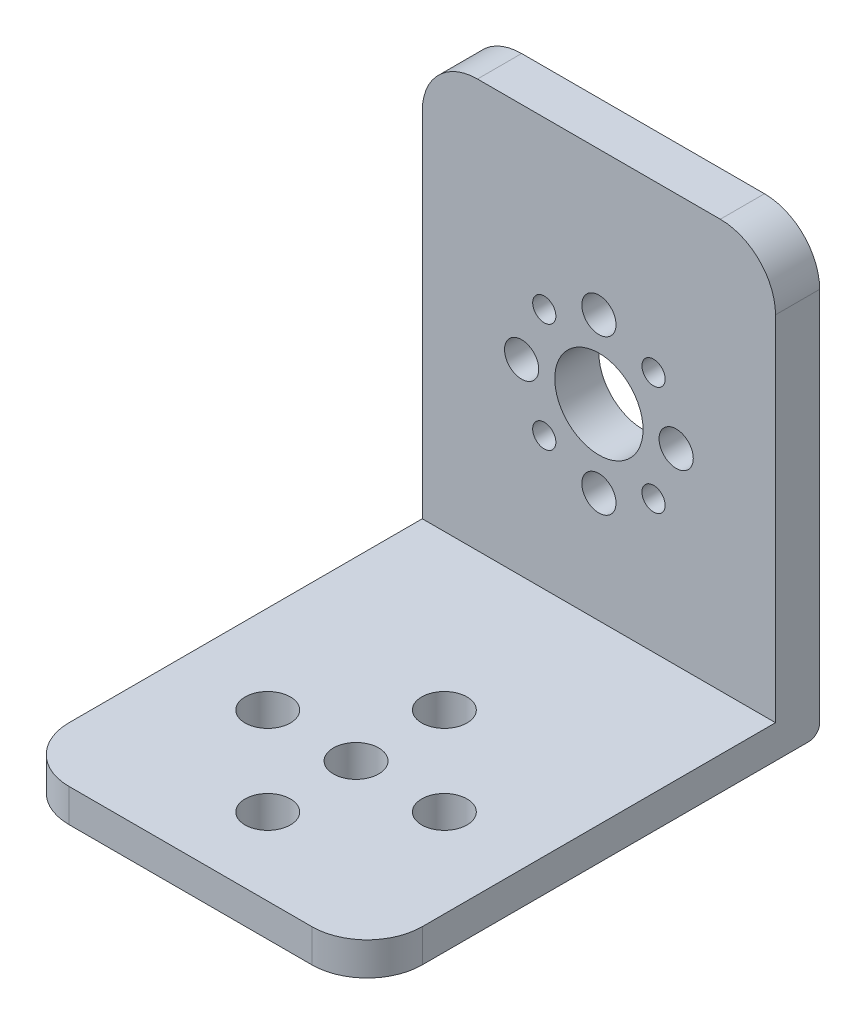
from build123d import *

# Parameters (mm, degrees)
SKETCH_2_W          = 32
SKETCH_2_H          = 40
EXTRUDE_1_DEPTH     = 3
SKETCH_3_W          = 32
SKETCH_3_H          = 3
EXTRUDE_2_DEPTH     = 37
SKETCH_4_R          = 4
SKETCH_4_R_2        = 1.55
SKETCH_4_R_3        = 1.05
CUT_EXTRUDE_1_DEPTH = 57.789083458
SKETCH_6_R          = 2.05
CUT_EXTRUDE_2_DEPTH = 46
FILLET_1_R          = 5
SKETCH_11_R         = 1.55
SKETCH_11_R_2       = 1.05
SKETCH_11_R_3       = 4
EXTRUDE_4_DEPTH     = 1
FILLET_3_R          = 1


with BuildPart() as part:
    # 草图2 → 凸台-拉伸1 (new body)
    with BuildSketch(Plane(origin=(0, 0, 0), x_dir=(1, 0, 0), z_dir=(0, 1, 0))):
        Rectangle(SKETCH_2_W, SKETCH_2_H)
    extrude(amount=EXTRUDE_1_DEPTH)

    # 草图3 → 凸台-拉伸2 (add)
    with BuildSketch(Plane(origin=(0, 3, 0), x_dir=(1, 0, 0), z_dir=(0, 1, 0))):
        with Locations((0, 18.5)):
            Rectangle(SKETCH_3_W, SKETCH_3_H)
    extrude(amount=EXTRUDE_2_DEPTH)

    # 草图4 → 切除-拉伸1 (cut, through all)
    with BuildSketch(Plane.XY.offset(-17)):
        with Locations((0, 20)):
            Circle(SKETCH_4_R)
        with Locations((7, 20)):
            Circle(SKETCH_4_R_2)
        with Locations((0, 13)):
            Circle(SKETCH_4_R_2)
        with Locations((-7, 20)):
            Circle(SKETCH_4_R_2)
        with Locations((0, 27)):
            Circle(SKETCH_4_R_2)
        with Locations((4.949747468, 24.949747468)):
            Circle(SKETCH_4_R_3)
        with Locations((4.949747468, 15.050252532)):
            Circle(SKETCH_4_R_3)
        with Locations((-4.949747468, 15.050252532)):
            Circle(SKETCH_4_R_3)
        with Locations((-4.949747468, 24.949747468)):
            Circle(SKETCH_4_R_3)
    extrude(amount=-CUT_EXTRUDE_1_DEPTH, mode=Mode.SUBTRACT)

    # 草图6 → 切除-拉伸2 (cut, through all)
    with BuildSketch(Plane(origin=(0, 3, 0), x_dir=(1, 0, 0), z_dir=(0, 1, 0))):
        with Locations(Location((0, -5, 0), (0, 0, 270))):
            Circle(SKETCH_6_R)
        with Locations(Location((-8, -5, 0), (0, 0, 270))):
            Circle(SKETCH_6_R)
        with Locations(Location((8, -5, 0), (0, 0, 270))):
            Circle(SKETCH_6_R)
        with Locations(Location((0, 3, 0), (0, 0, 270))):
            Circle(SKETCH_6_R)
        with Locations(Location((0, -13, 0), (0, 0, 270))):
            Circle(SKETCH_6_R)
    extrude(amount=-CUT_EXTRUDE_2_DEPTH, mode=Mode.SUBTRACT)

    # 圆角1
    fillet_1_edges = [part.edges().sort_by_distance(p)[0] for p in [
        (-16, 40, -18.5),
        (16, 40, -18.5),
        (16, 1.5, 20),
        (-16, 1.5, 20),
    ]]
    fillet(fillet_1_edges, radius=FILLET_1_R)

    # 草图11 → 凸台-拉伸4 (add)
    with BuildSketch(Plane(origin=(0, 0, -20), x_dir=(-1, 0, 0), z_dir=(0, 0, -1))):
        with BuildLine():
            Line((11, 40), (-11, 40))
            ThreePointArc((-11, 40), (-14.535533906, 38.535533906), (-16, 35))
            Line((-16, 35), (-16, 0))
            Line((-16, 0), (16, 0))
            Line((16, 0), (16, 35))
            ThreePointArc((16, 35), (14.535533906, 38.535533906), (11, 40))
        make_face()
        with Locations(Location((-7, 20, 0), (0, 0, 180))):
            Circle(SKETCH_11_R, mode=Mode.SUBTRACT)
        with Locations(Location((-4.949747468, 15.050252532, 0), (0, 0, 180))):
            Circle(SKETCH_11_R_2, mode=Mode.SUBTRACT)
        with Locations(Location((0, 13, 0), (0, 0, 180))):
            Circle(SKETCH_11_R, mode=Mode.SUBTRACT)
        with Locations(Location((0, 20, 0), (0, 0, 180))):
            Circle(SKETCH_11_R_3, mode=Mode.SUBTRACT)
        with Locations(Location((4.949747468, 15.050252532, 0), (0, 0, 180))):
            Circle(SKETCH_11_R_2, mode=Mode.SUBTRACT)
        with Locations(Location((7, 20, 0), (0, 0, 180))):
            Circle(SKETCH_11_R, mode=Mode.SUBTRACT)
        with Locations(Location((4.949747468, 24.949747468, 0), (0, 0, 180))):
            Circle(SKETCH_11_R_2, mode=Mode.SUBTRACT)
        with Locations(Location((-4.949747468, 24.949747468, 0), (0, 0, 180))):
            Circle(SKETCH_11_R_2, mode=Mode.SUBTRACT)
        with Locations(Location((0, 27, 0), (0, 0, 180))):
            Circle(SKETCH_11_R, mode=Mode.SUBTRACT)
    extrude(amount=EXTRUDE_4_DEPTH)

    # 圆角3
    fillet_3_edges = [part.edges().sort_by_distance(p)[0] for p in [
        (0, 0, -21),
    ]]
    fillet(fillet_3_edges, radius=FILLET_3_R)


solid = part.part
